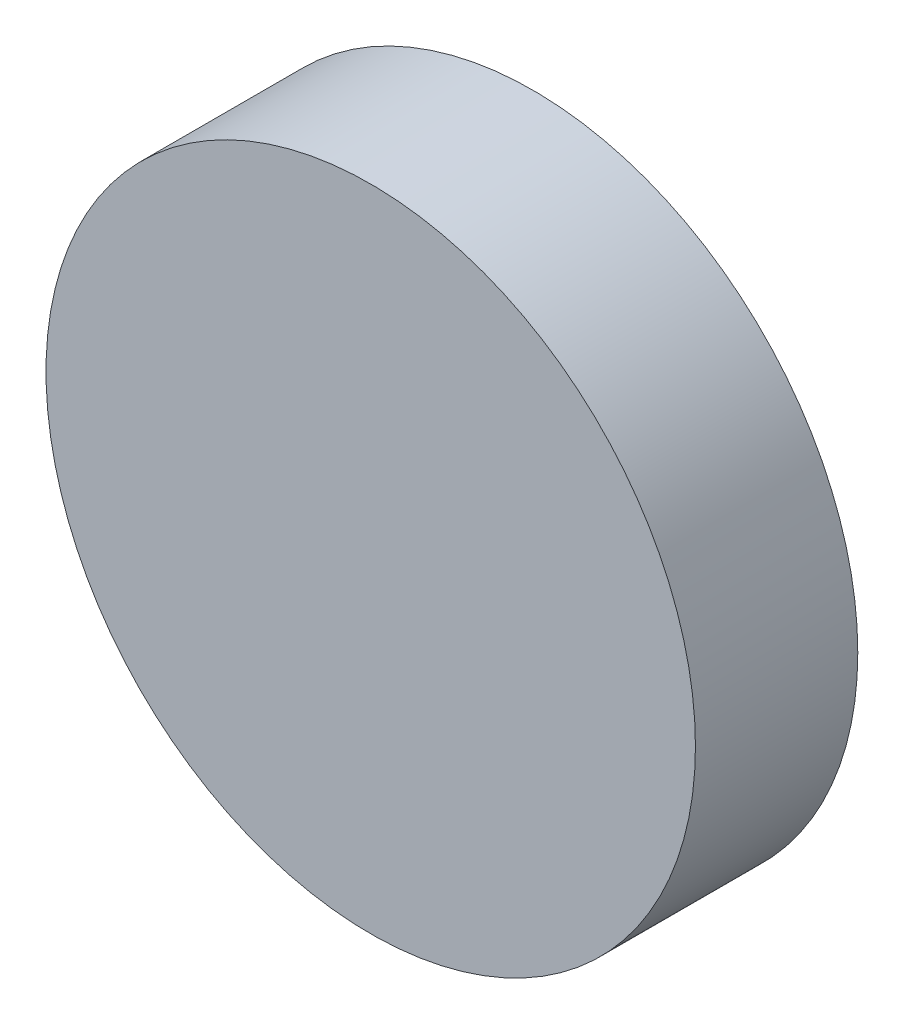
from build123d import *

# Parameters (mm, degrees)
ESQUISSE1_R        = 25.4
BOSS_EXTRU_1_DEPTH = 12.7


with BuildPart() as part:
    # Esquisse1 → Boss.-Extru.1 (new body)
    with BuildSketch(Plane.XY):
        Circle(ESQUISSE1_R)
    extrude(amount=BOSS_EXTRU_1_DEPTH)


solid = part.part
